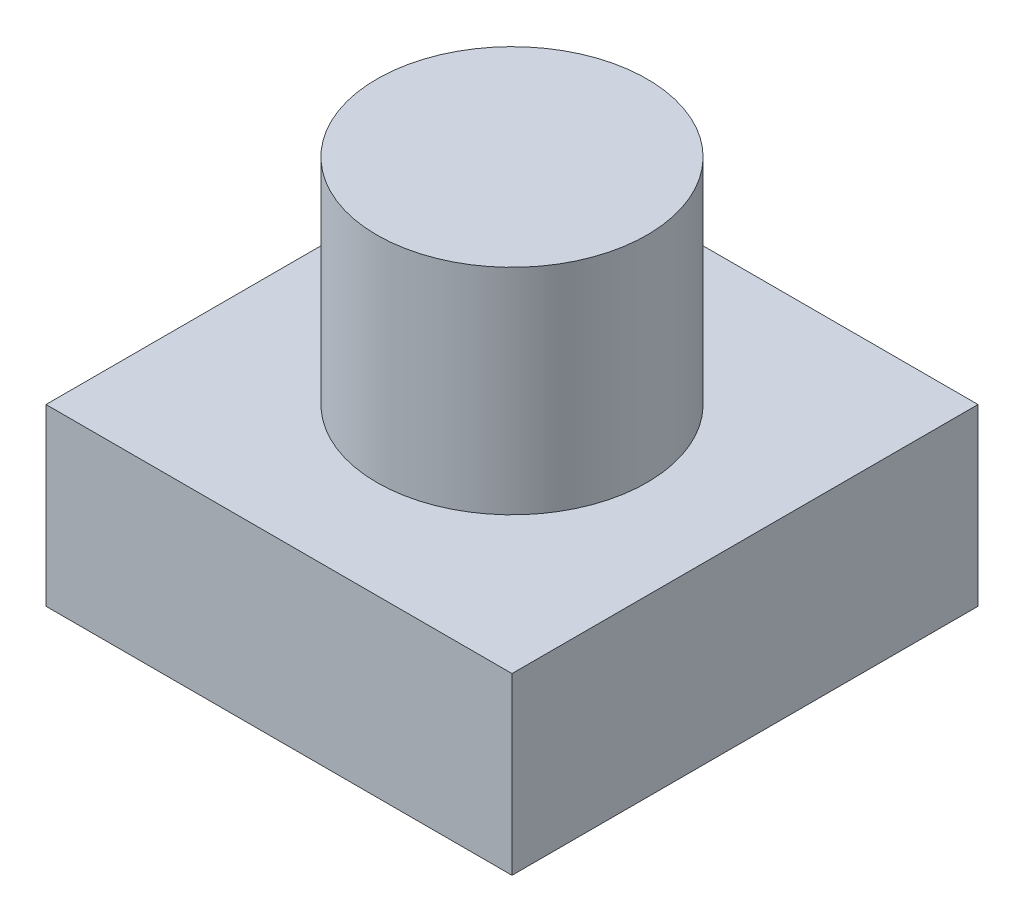
from build123d import *

# Parameters (mm, degrees)
SKETCH1_R           = 3.683
BOSS_EXTRUDE1_DEPTH = 5.842
SKETCH2_W           = 12.7
SKETCH2_H           = 12.7
BOSS_EXTRUDE2_DEPTH = 4.7625


with BuildPart() as part:
    # Sketch1 → Boss-Extrude1 (new body)
    with BuildSketch(Plane(origin=(0, 0, 0), x_dir=(1, 0, 0), z_dir=(0, 1, 0))):
        with Locations(Location((0, 0, 0), (0, 0, 270))):
            Circle(SKETCH1_R)
    extrude(amount=BOSS_EXTRUDE1_DEPTH)

    # Sketch2 → Boss-Extrude2 (add)
    with BuildSketch(Plane.XZ):
        Rectangle(SKETCH2_W, SKETCH2_H)
    extrude(amount=BOSS_EXTRUDE2_DEPTH)


solid = part.part
